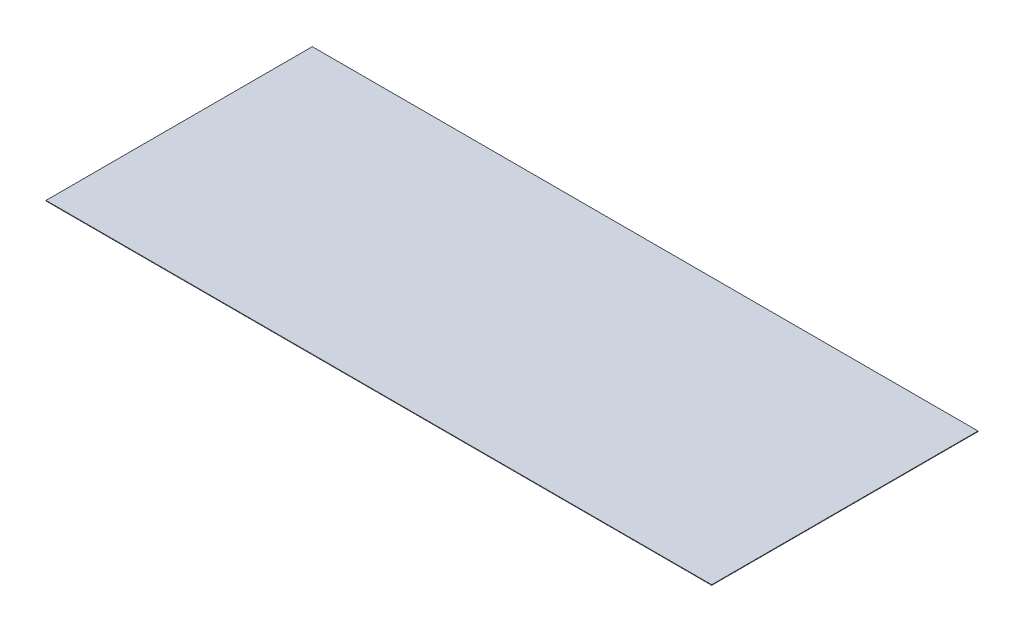
from build123d import *

# Parameters (mm, degrees)
SKETCH1_W           = 250
SKETCH1_H           = 100
BOSS_EXTRUDE1_DEPTH = 0.2


with BuildPart() as part:
    # Sketch1 → Boss-Extrude1 (new body)
    with BuildSketch(Plane(origin=(0, 0, 0), x_dir=(1, 0, 0), z_dir=(0, 1, 0))):
        Rectangle(SKETCH1_W, SKETCH1_H)
    extrude(amount=BOSS_EXTRUDE1_DEPTH)


solid = part.part
